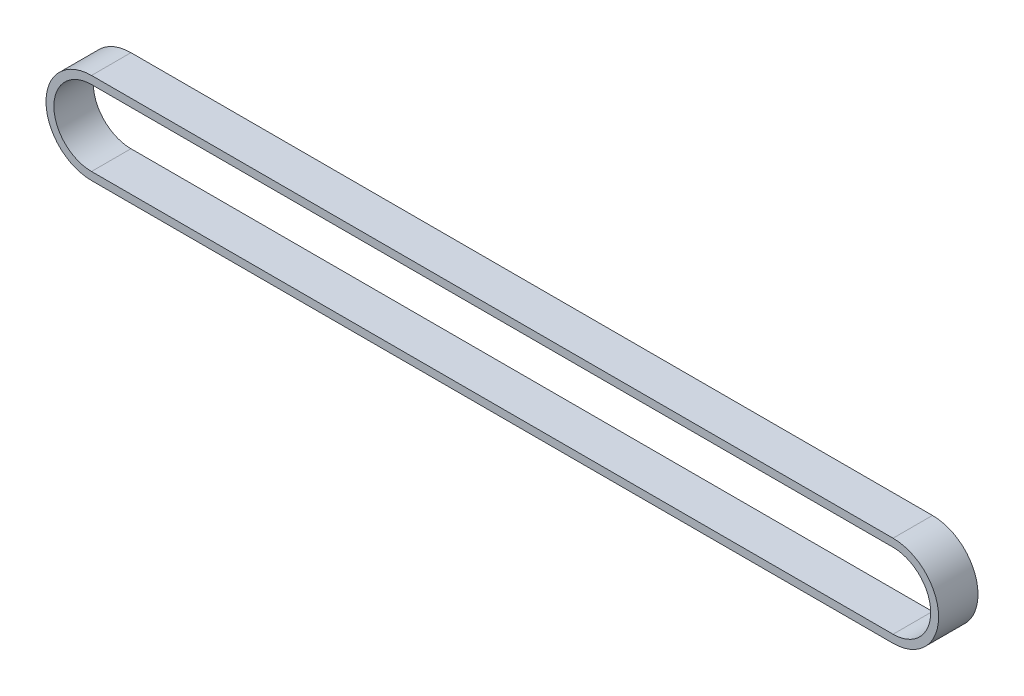
from build123d import *

# Parameters (mm, degrees)
EXTRUDE_THIN1_DEPTH = 7.5


with BuildPart() as part:
    # Sketch2 → Extrude-Thin1 (new, symmetric)
    with BuildSketch(Plane.XY):
        with BuildLine():
            Line((0, -17.325), (-304.996685237, -17.325))
            ThreePointArc((-304.996685237, -17.325), (-322.321685237, 0), (-304.996685237, 17.325))
            Line((-304.996685237, 17.325), (0, 17.325))
            ThreePointArc((0, 17.325), (17.325, 0), (0, -17.325))
        make_face()
        with BuildLine():
            Line((0, -14.325), (-304.996685237, -14.325))
            ThreePointArc((-304.996685237, -14.325), (-319.321685237, 0), (-304.996685237, 14.325))
            Line((-304.996685237, 14.325), (0, 14.325))
            ThreePointArc((0, 14.325), (14.325, 0), (0, -14.325))
        make_face(mode=Mode.SUBTRACT)
    extrude(amount=EXTRUDE_THIN1_DEPTH, both=True)


solid = part.part
